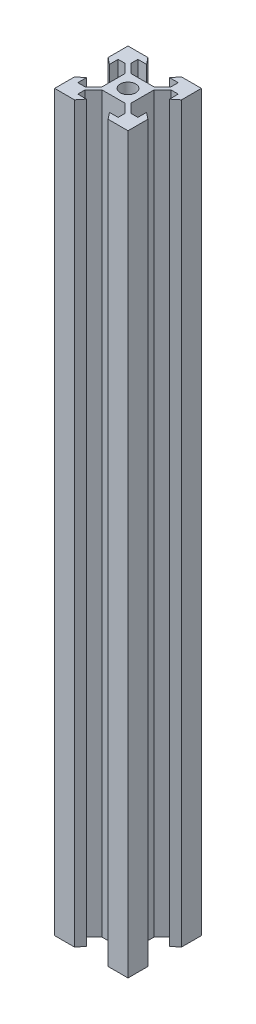
from build123d import *

# Parameters (mm, degrees)
SKETCH1_R           = 2.1
BOSS_EXTRUDE1_DEPTH = 200


with BuildPart() as part:
    # Sketch1 → Boss-Extrude1 (new body)
    with BuildSketch(Plane(origin=(0, 0, 0), x_dir=(1, 0, 0), z_dir=(0, 1, 0))):
        Polygon((0, 5.415), (0, 0), (4.5, 0), (5.42, 0), (6.875, 1.8), (4.5, 1.8), (4.5, 3.75), (6.85, 6.1), (13.15, 6.1), (15.5, 3.75), (15.5, 1.8), (13.147527473, 1.8), (14.58, 0), (20, 0), (20, 4.5), (20, 5.415), (18.2, 6.85), (18.2, 5.415), (18.2, 4.5), (16.25, 4.5), (13.9, 6.85), (13.9, 13.15), (16.25, 15.5), (18.2, 15.5), (18.2, 13.12), (20, 14.58), (20, 20), (15.5, 20), (14.58, 20), (13.125, 18.2), (15.5, 18.2), (15.5, 16.25), (13.15, 13.9), (6.85, 13.9), (4.5, 16.25), (4.5, 18.2), (6.875, 18.2), (5.42, 20), (4.5, 20), (0, 20), (0, 14.700042406), (0, 14.58), (1.8, 13.125), (1.8, 14.58), (1.8, 14.700042406), (1.8, 15.5), (3.75, 15.5), (6.1, 13.15), (6.1, 6.85), (3.75, 4.5), (1.8, 4.5), (1.8, 5.415), (1.8, 6.875), align=None)
        with Locations(Location((10, 10, 0), (0, 0, 270))):
            Circle(SKETCH1_R, mode=Mode.SUBTRACT)
    extrude(amount=BOSS_EXTRUDE1_DEPTH)


solid = part.part
